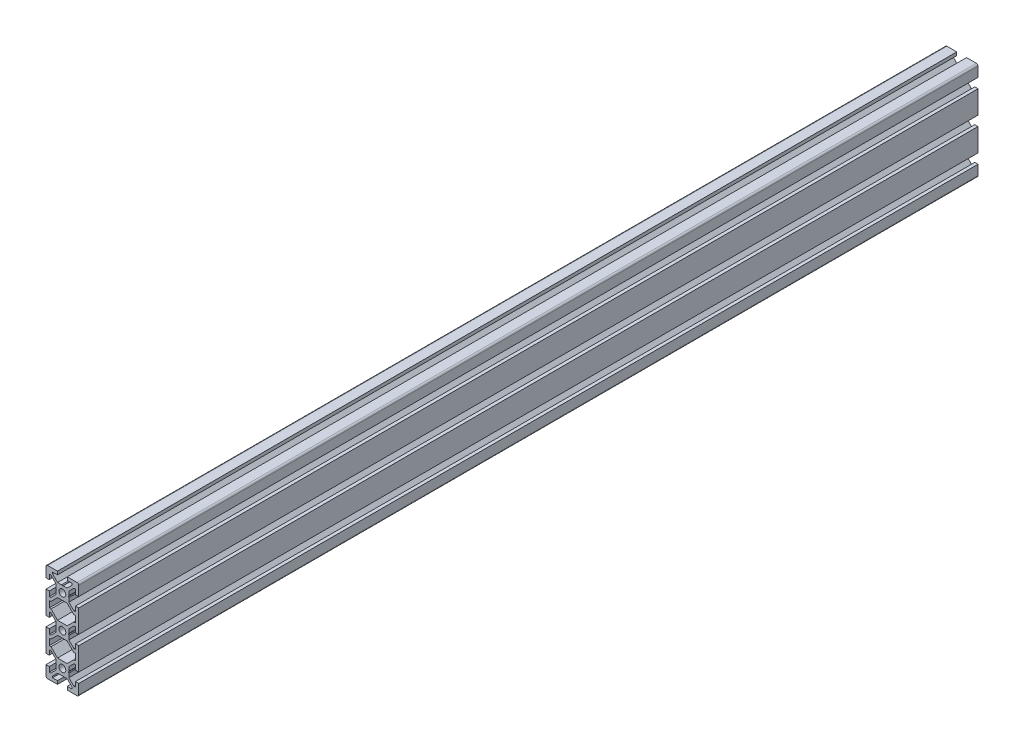
from build123d import *

# Parameters (mm, degrees)
BOSS_EXTRUDE1_DEPTH = 550
SKETCH2_W           = 550
SKETCH2_H           = 2.1
SKETCH3_W           = 550
SKETCH3_H           = 2.1
SKETCH4_W           = 550
SKETCH4_H           = 2.1


with BuildPart() as part:
    # Sketch1 → Boss-Extrude1 (new body)
    with BuildSketch(Plane.XY):
        with BuildLine():
            Line((-10, -17), (-8, -17))
            Line((-8, -17), (-8, -14))
            Line((-8, -14), (-7.060660172, -14))
            Line((-7.060660172, -14), (-4, -17.060660172))
            Line((-4, -17.060660172), (-4, -19.480384758))
            Line((-4, -19.480384758), (-3.7, -20))
            Line((-3.7, -20), (-4, -20.519615242))
            Line((-4, -20.519615242), (-4, -22.939339828))
            Line((-4, -22.939339828), (-7.060660172, -26))
            Line((-7.060660172, -26), (-8, -26))
            Line((-8, -26), (-8, -23))
            Line((-8, -23), (-10, -23))
            Line((-10, -23), (-10, -29))
            ThreePointArc((-10, -29), (-9.707106781, -29.707106781), (-9, -30))
            Line((-9, -30), (-3, -30))
            Line((-3, -30), (-3, -28))
            Line((-3, -28), (-6, -28))
            Line((-6, -28), (-6, -27.060660172))
            Line((-6, -27.060660172), (-2.939339828, -24))
            Line((-2.939339828, -24), (-0.519615242, -24))
            Line((-0.519615242, -24), (0, -23.7))
            Line((0, -23.7), (0.519615242, -24))
            Line((0.519615242, -24), (2.939339828, -24))
            Line((2.939339828, -24), (6, -27.060660172))
            Line((6, -27.060660172), (6, -28))
            Line((6, -28), (3, -28))
            Line((3, -28), (3, -30))
            Line((3, -30), (9, -30))
            ThreePointArc((9, -30), (9.707106781, -29.707106781), (10, -29))
            Line((10, -29), (10, -23))
            Line((10, -23), (8, -23))
            Line((8, -23), (8, -26))
            Line((8, -26), (7.060660172, -26))
            Line((7.060660172, -26), (4, -22.939339828))
            Line((4, -22.939339828), (4, -20.519615242))
            Line((4, -20.519615242), (3.7, -20))
            Line((3.7, -20), (4, -19.480384758))
            Line((4, -19.480384758), (4, -17.060660172))
            Line((4, -17.060660172), (7.060660172, -14))
            Line((7.060660172, -14), (8, -14))
            Line((8, -14), (8, -17))
            Line((8, -17), (10, -17))
            Line((10, -17), (10, -3))
            Line((10, -3), (8, -3))
            Line((8, -3), (8, -6))
            Line((8, -6), (7.060660172, -6))
            Line((7.060660172, -6), (4, -2.939339828))
            Line((4, -2.939339828), (4, -0.519615242))
            Line((4, -0.519615242), (3.7, 0))
            Line((3.7, 0), (4, 0.519615242))
            Line((4, 0.519615242), (4, 2.939339828))
            Line((4, 2.939339828), (7.060660172, 6))
            Line((7.060660172, 6), (8, 6))
            Line((8, 6), (8, 3))
            Line((8, 3), (10, 3))
            Line((10, 3), (10, 17))
            Line((10, 17), (8, 17))
            Line((8, 17), (8, 14))
            Line((8, 14), (7.060660172, 14))
            Line((7.060660172, 14), (4, 17.060660172))
            Line((4, 17.060660172), (4, 19.480384758))
            Line((4, 19.480384758), (3.7, 20))
            Line((3.7, 20), (4, 20.519615242))
            Line((4, 20.519615242), (4, 22.939339828))
            Line((4, 22.939339828), (7.060660172, 26))
            Line((7.060660172, 26), (8, 26))
            Line((8, 26), (8, 23))
            Line((8, 23), (10, 23))
            Line((10, 23), (10, 29))
            ThreePointArc((10, 29), (9.707106781, 29.707106781), (9, 30))
            Line((9, 30), (3, 30))
            Line((3, 30), (3, 28))
            Line((3, 28), (6, 28))
            Line((6, 28), (6, 27.060660172))
            Line((6, 27.060660172), (2.939339828, 24))
            Line((2.939339828, 24), (0.519615242, 24))
            Line((0.519615242, 24), (0, 23.7))
            Line((0, 23.7), (-0.519615242, 24))
            Line((-0.519615242, 24), (-2.939339828, 24))
            Line((-2.939339828, 24), (-6, 27.060660172))
            Line((-6, 27.060660172), (-6, 28))
            Line((-6, 28), (-3, 28))
            Line((-3, 28), (-3, 30))
            Line((-3, 30), (-9, 30))
            ThreePointArc((-9, 30), (-9.707106781, 29.707106781), (-10, 29))
            Line((-10, 29), (-10, 23))
            Line((-10, 23), (-8, 23))
            Line((-8, 23), (-8, 26))
            Line((-8, 26), (-7.060660172, 26))
            Line((-7.060660172, 26), (-4, 22.939339828))
            Line((-4, 22.939339828), (-4, 20.519615242))
            Line((-4, 20.519615242), (-3.7, 20))
            Line((-3.7, 20), (-4, 19.480384758))
            Line((-4, 19.480384758), (-4, 17.060660172))
            Line((-4, 17.060660172), (-7.060660172, 14))
            Line((-7.060660172, 14), (-8, 14))
            Line((-8, 14), (-8, 17))
            Line((-8, 17), (-10, 17))
            Line((-10, 17), (-10, 3))
            Line((-10, 3), (-8, 3))
            Line((-8, 3), (-8, 6))
            Line((-8, 6), (-7.060660172, 6))
            Line((-7.060660172, 6), (-4, 2.939339828))
            Line((-4, 2.939339828), (-4, 0.519615242))
            Line((-4, 0.519615242), (-3.7, 0))
            Line((-3.7, 0), (-4, -0.519615242))
            Line((-4, -0.519615242), (-4, -2.939339828))
            Line((-4, -2.939339828), (-7.060660172, -6))
            Line((-7.060660172, -6), (-8, -6))
            Line((-8, -6), (-8, -3))
            Line((-8, -3), (-10, -3))
            Line((-10, -3), (-10, -17))
        make_face()
        Polygon((-8, 8), (-6.939339828, 8), (-2.939339828, 4), (2.939339828, 4), (6.939339828, 8), (8, 8), (8, 12), (6.939339828, 12), (2.939339828, 16), (-2.939339828, 16), (-6.939339828, 12), (-8, 12), align=None, mode=Mode.SUBTRACT)
        Polygon((-8, -8), (-8, -12), (-6.939339828, -12), (-2.939339828, -16), (2.939339828, -16), (6.939339828, -12), (8, -12), (8, -8), (6.939339828, -8), (2.939339828, -4), (-2.939339828, -4), (-6.939339828, -8), align=None, mode=Mode.SUBTRACT)
    extrude(amount=-BOSS_EXTRUDE1_DEPTH)

    # Sketch2 → Cut-Revolve1 (revolve, cut)
    with BuildSketch(Plane(origin=(0, 0, 0), x_dir=(0, 0, -1), z_dir=(1, 0, 0)), mode=Mode.PRIVATE) as cut_revolve1_sk:
        with Locations((275, 18.95)):
            Rectangle(SKETCH2_W, SKETCH2_H)
    revolve(cut_revolve1_sk.sketch.rotate(Axis((0, 20, 0), (0, 0, -1)), 90), axis=Axis((0, 20, 0), (0, 0, -1)), mode=Mode.SUBTRACT)

    # Sketch3 → Cut-Revolve2 (revolve, cut)
    with BuildSketch(Plane(origin=(0, 0, 0), x_dir=(0, 0, -1), z_dir=(1, 0, 0)), mode=Mode.PRIVATE) as cut_revolve2_sk:
        with Locations((275, -1.05)):
            Rectangle(SKETCH3_W, SKETCH3_H)
    revolve(cut_revolve2_sk.sketch.rotate(Axis((0, 0, 0), (0, 0, -1)), 90), axis=Axis((0, 0, 0), (0, 0, -1)), mode=Mode.SUBTRACT)

    # Sketch4 → Cut-Revolve3 (revolve, cut)
    with BuildSketch(Plane(origin=(0, 0, 0), x_dir=(0, 0, -1), z_dir=(1, 0, 0)), mode=Mode.PRIVATE) as cut_revolve3_sk:
        with Locations((275, -21.05)):
            Rectangle(SKETCH4_W, SKETCH4_H)
    revolve(cut_revolve3_sk.sketch.rotate(Axis((0, -20, 0), (0, 0, -1)), 90), axis=Axis((0, -20, 0), (0, 0, -1)), mode=Mode.SUBTRACT)


solid = part.part
